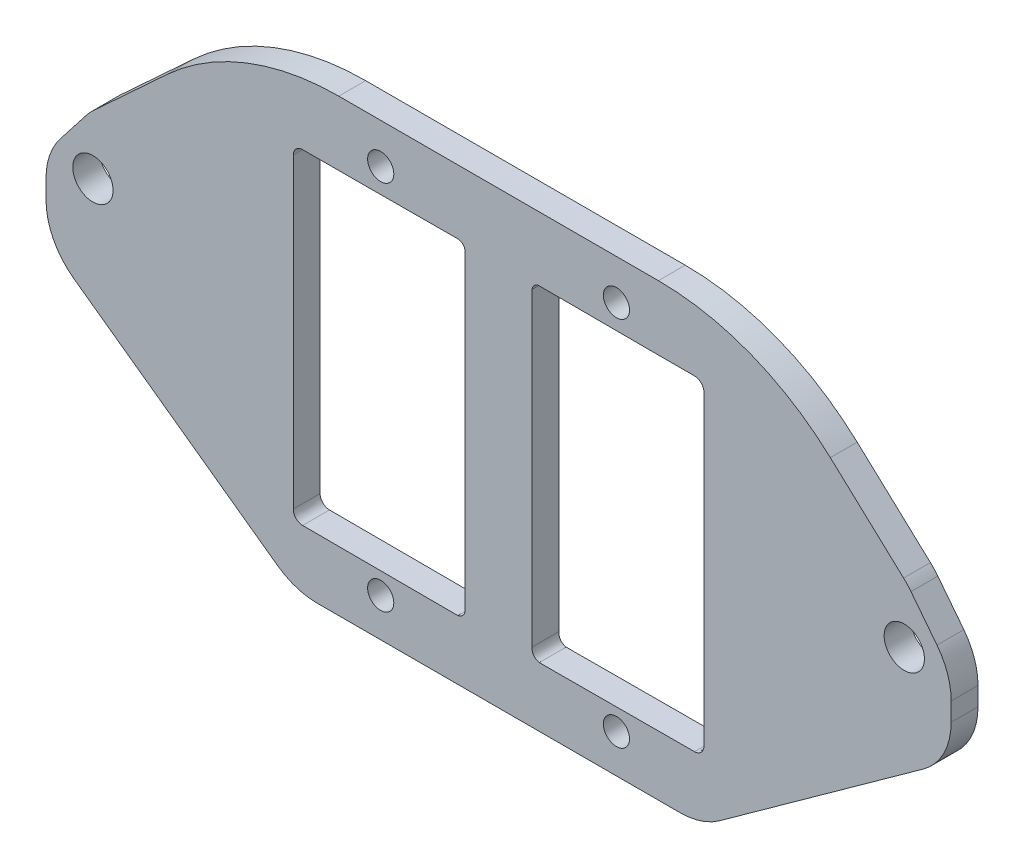
from build123d import *

# Parameters (mm, degrees)
ESQUISSE1_R             = 1.5
ESQUISSE1_R_2           = 0.975
BOSS_EXTRU_3_DEPTH      = 2
ESQUISSE2_R             = 1.5
ENL_V_MAT_EXTRU_1_DEPTH = 10


with BuildPart() as part:
    # Esquisse1 → Boss.-Extru.3 (new body)
    with BuildSketch(Plane.XY):
        with BuildLine():
            Line((31.640550531, -4.887241018), (16.450544828, -15.819470843))
            ThreePointArc((16.450544828, -15.819470843), (15.064222472, -16.51996197), (13.529826111, -16.761219719))
            Line((13.529826111, -16.761219719), (-13.529826111, -16.761219719))
            ThreePointArc((-13.529826111, -16.761219719), (-15.064222472, -16.51996197), (-16.450544828, -15.819470843))
            Line((-16.450544828, -15.819470843), (-31.640550531, -4.887241018))
            ThreePointArc((-31.640550531, -4.887241018), (-33.169752802, -3.108946738), (-33.719831815, -0.828989895))
            Line((-33.719831815, -0.828989895), (-33.719831815, 0.549989061))
            ThreePointArc((-33.719831815, 0.549989061), (-33.448369589, 2.175083064), (-32.663459607, 3.623716413))
            Line((-32.663459607, 3.623716413), (-30.727499402, 6.107575779))
            ThreePointArc((-30.727499402, 6.107575779), (-30.464326323, 6.418261685), (-30.17674656, 6.706504084))
            Line((-30.17674656, 6.706504084), (-24.719522272, 11.748000297))
            ThreePointArc((-24.719522272, 11.748000297), (-18.785145606, 15.463312907), (-11.905042981, 16.761219719))
            Line((-11.905042981, 16.761219719), (11.905042981, 16.761219719))
            ThreePointArc((11.905042981, 16.761219719), (18.785145606, 15.463312907), (24.719522272, 11.748000297))
            Line((24.719522272, 11.748000297), (30.17674656, 6.706504084))
            ThreePointArc((30.17674656, 6.706504084), (30.464326323, 6.418261685), (30.727499402, 6.107575779))
            Line((30.727499402, 6.107575779), (32.663459607, 3.623716413))
            ThreePointArc((32.663459607, 3.623716413), (33.448369589, 2.175083064), (33.719831815, 0.549989061))
            Line((33.719831815, 0.549989061), (33.719831815, -0.828989895))
            ThreePointArc((33.719831815, -0.828989895), (33.169752802, -3.108946738), (31.640550531, -4.887241018))
        make_face()
        with Locations((-30.225692015, 2.268354752)):
            Circle(ESQUISSE1_R, mode=Mode.SUBTRACT)
        with Locations((-8.782063878, 13.78106332)):
            Circle(ESQUISSE1_R_2, mode=Mode.SUBTRACT)
        with Locations((-8.782063878, -13.88893668)):
            Circle(ESQUISSE1_R_2, mode=Mode.SUBTRACT)
        with Locations((8.782063878, -13.88893668)):
            Circle(ESQUISSE1_R_2, mode=Mode.SUBTRACT)
        with Locations((8.782063878, 13.78106332)):
            Circle(ESQUISSE1_R_2, mode=Mode.SUBTRACT)
        with Locations((30.225692015, 2.268354752)):
            Circle(ESQUISSE1_R, mode=Mode.SUBTRACT)
        with BuildLine():
            Line((-2.5, 11.487169319), (-2.5, -11.576554556))
            add(Edge.make_bspline(
                [(-2.5, -11.576554556), (-2.473208566, -11.739357127), (-2.553615023, -12.100978181), (-2.87033079, -12.292815757), (-3.033099085, -12.319601551)],
                knots=[0, 0, 0, 0, 0.785398163, 1.570796327, 1.570796327, 1.570796327, 1.570796327], degree=3))
            Line((-3.033099085, -12.319601551), (-14.597943906, -12.285266489))
            add(Edge.make_bspline(
                [(-14.597943906, -12.285266489), (-14.777700694, -12.284097516), (-15.151218557, -12.131430398), (-15.299227824, -11.755845667), (-15.298058605, -11.576051026)],
                knots=[1.570796327, 1.570796327, 1.570796327, 1.570796327, 2.35619449, 3.141592654, 3.141592654, 3.141592654, 3.141592654], degree=3))
            Line((-15.298058605, -11.576051026), (-15.298037902, 11.261063321))
            add(Edge.make_bspline(
                [(-15.298037902, 11.261063321), (-15.29803156, 11.4396883), (-15.148551709, 11.811852348), (-14.776487869, 11.961093545), (-14.597900496, 11.961087204)],
                knots=[0, 0, 0, 0, 0.785398163, 1.570796327, 1.570796327, 1.570796327, 1.570796327], degree=3))
            Line((-14.597900496, 11.961087204), (-11.128260179, 11.961087204))
            Line((-11.128260179, 11.961087204), (-3.087360016, 11.987859762))
            add(Edge.make_bspline(
                [(-3.087360016, 11.987859762), (-2.948581163, 11.998907943), (-2.650223858, 11.905940648), (-2.511050508, 11.625977396), (-2.5, 11.487169319)],
                knots=[1.570796327, 1.570796327, 1.570796327, 1.570796327, 2.35619449, 3.141592654, 3.141592654, 3.141592654, 3.141592654], degree=3))
        make_face(mode=Mode.SUBTRACT)
        with BuildLine():
            Line((3.033099085, -12.319601551), (14.597943906, -12.285266489))
            add(Edge.make_bspline(
                [(14.597943906, -12.285266489), (14.777700694, -12.284097516), (15.151218557, -12.131430398), (15.299227824, -11.755845667), (15.298058605, -11.576051026)],
                knots=[1.570796327, 1.570796327, 1.570796327, 1.570796327, 2.35619449, 3.141592654, 3.141592654, 3.141592654, 3.141592654], degree=3))
            Line((15.298058605, -11.576051026), (15.298037902, 11.261063321))
            add(Edge.make_bspline(
                [(15.298037902, 11.261063321), (15.29803156, 11.4396883), (15.148551709, 11.811852348), (14.776487869, 11.961093545), (14.597900496, 11.961087204)],
                knots=[0, 0, 0, 0, 0.785398163, 1.570796327, 1.570796327, 1.570796327, 1.570796327], degree=3))
            Line((14.597900496, 11.961087204), (11.128260179, 11.961087204))
            Line((11.128260179, 11.961087204), (3.087360016, 11.987859762))
            add(Edge.make_bspline(
                [(3.087360016, 11.987859762), (2.948581163, 11.998907943), (2.650223858, 11.905940648), (2.511050508, 11.625977396), (2.5, 11.487169319)],
                knots=[1.570796327, 1.570796327, 1.570796327, 1.570796327, 2.35619449, 3.141592654, 3.141592654, 3.141592654, 3.141592654], degree=3))
            Line((2.5, 11.487169319), (2.5, -11.576554556))
            add(Edge.make_bspline(
                [(2.5, -11.576554556), (2.473208566, -11.739357127), (2.553615023, -12.100978181), (2.87033079, -12.292815757), (3.033099085, -12.319601551)],
                knots=[0, 0, 0, 0, 0.785398163, 1.570796327, 1.570796327, 1.570796327, 1.570796327], degree=3))
        make_face(mode=Mode.SUBTRACT)
    extrude(amount=BOSS_EXTRU_3_DEPTH)

    # Esquisse2 → Enlèv. mat.-Extru.1 (cut)
    with BuildSketch(Plane.XY.offset(2)):
        with Locations((29.955535999, 19.762236701)):
            Circle(ESQUISSE2_R)
        with Locations((-60.239561974, 19.762236701)):
            Circle(ESQUISSE2_R)
    extrude(amount=-ENL_V_MAT_EXTRU_1_DEPTH, mode=Mode.SUBTRACT)


solid = part.part
